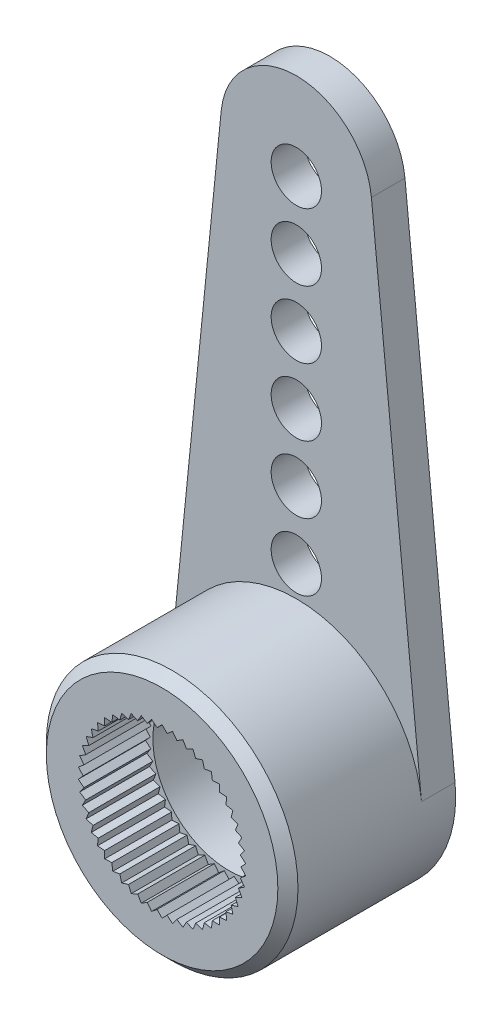
from build123d import *
from build123d.topology import SkipClean

# Parameters (mm, degrees)
BOSS_EXTRUDE1_DEPTH = 1
SKETCH2_R           = 3.75
SKETCH2_R_2         = 2.275
BOSS_EXTRUDE2_DEPTH = 4
SKETCH3_R           = 2
CUT_EXTRUDE1_DEPTH  = 0.8
SKETCH4_R           = 0.75
CUT_EXTRUDE2_DEPTH  = 0.2
SKETCH5_R           = 0.75
CUT_EXTRUDE3_DEPTH  = 1
CHAMFER1_SIZE       = 0.3
CUT_EXTRUDE4_START  = -2
CUT_EXTRUDE4_DEPTH  = 2
CIRPATTERN1_COUNT   = 50


with BuildPart() as part:
    # Sketch1 → Boss-Extrude1 (new body)
    with BuildSketch(Plane.XY):
        with BuildLine():
            Line((-3.731202889, 0.375), (-2.238721733, 15.225))
            ThreePointArc((-2.238721733, 15.225), (0, 17.25), (2.238721733, 15.225))
            Line((2.238721733, 15.225), (3.731202889, 0.375))
            ThreePointArc((3.731202889, 0.375), (0, -3.75), (-3.731202889, 0.375))
        make_face()
    extrude(amount=BOSS_EXTRUDE1_DEPTH)

    # Sketch2 → Boss-Extrude2 (add)
    with SkipClean():  # the faces are left unmerged after this step: merging them gives an invalid solid
        with BuildSketch(Plane.XY.offset(1)):
            with Locations(Location((0, 0, 0), (0, 0, 174.260829523))):
                Circle(SKETCH2_R)
            Circle(SKETCH2_R_2, mode=Mode.SUBTRACT)
        extrude(amount=BOSS_EXTRUDE2_DEPTH)

    # Sketch3 → Cut-Extrude1 (cut)
    with SkipClean():  # the faces are left unmerged after this step: merging them gives an invalid solid
        with BuildSketch(Plane(origin=(0, 0, 0), x_dir=(-1, 0, 0), z_dir=(0, 0, -1))):
            Circle(SKETCH3_R)
        extrude(amount=-CUT_EXTRUDE1_DEPTH, mode=Mode.SUBTRACT)

    # Sketch4 → Cut-Extrude2 (cut)
    with SkipClean():  # the faces are left unmerged after this step: merging them gives an invalid solid
        with BuildSketch(Plane(origin=(0, 0, 0.8), x_dir=(-1, 0, 0), z_dir=(0, 0, -1))):
            Circle(SKETCH4_R)
        extrude(amount=-CUT_EXTRUDE2_DEPTH, mode=Mode.SUBTRACT)

    # Sketch5 → Cut-Extrude3 (cut)
    with SkipClean():  # the faces are left unmerged after this step: merging them gives an invalid solid
        with BuildSketch(Plane(origin=(0, 0, 0), x_dir=(-1, 0, 0), z_dir=(0, 0, -1))):
            with Locations((0, 4.65)):
                Circle(SKETCH5_R)
            with Locations((0, 6.65)):
                Circle(SKETCH5_R)
            with Locations((0, 8.65)):
                Circle(SKETCH5_R)
            with Locations((0, 10.65)):
                Circle(SKETCH5_R)
            with Locations((0, 12.65)):
                Circle(SKETCH5_R)
            with Locations((0, 14.65)):
                Circle(SKETCH5_R)
        extrude(amount=-CUT_EXTRUDE3_DEPTH, mode=Mode.SUBTRACT)

    # Chamfer1
    chamfer1_edges = [part.edges().sort_by_distance(p)[0] for p in [
        (3.731202889, -0.375, 5),
    ]]
    chamfer(chamfer1_edges, length=CHAMFER1_SIZE)

    # Sketch7 → Cut-Extrude4 (cut)
    with SkipClean():  # the faces are left unmerged after this step: merging them gives an invalid solid
        with BuildSketch(Plane.XY.offset(5).offset(CUT_EXTRUDE4_START)):
            with BuildLine():
                Line((0.147557721, 2.345362812), (0, 2.5))
                Line((0, 2.5), (-0.147557721, 2.345362812))
                Line((-0.147557721, 2.345362812), (-0.142848432, 2.270510807))
                ThreePointArc((-0.142848432, 2.270510807), (0, 2.275), (0.142848432, 2.270510807))
                Line((0.142848432, 2.270510807), (0.147557721, 2.345362812))
            make_face()
        cut_extrude4 = extrude(amount=CUT_EXTRUDE4_DEPTH, mode=Mode.SUBTRACT)

    # CirPattern1: Cut-Extrude4 ×50 about axis
    with SkipClean():  # the faces are left unmerged after this step: merging them gives an invalid solid
        cirpattern1_axis = Axis((0, 0, 0), (0, 0, 1))
        for i in range(1, CIRPATTERN1_COUNT):
            add(cut_extrude4.rotate(cirpattern1_axis, i * 360 / CIRPATTERN1_COUNT), mode=Mode.SUBTRACT)


solid = part.part
